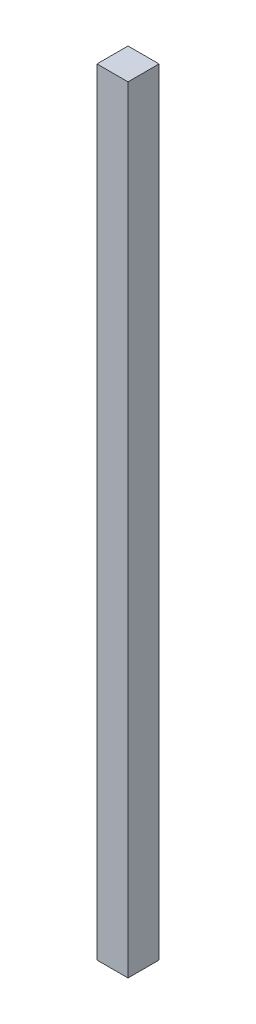
from build123d import *

# Parameters (mm, degrees)
SKETCH_1_W      = 40
SKETCH_1_H      = 40
EXTRUDE_1_DEPTH = 1000


with BuildPart() as part:
    # Эскиз1 → Бобышка-Вытянуть1 (new body)
    with BuildSketch(Plane(origin=(0, 0, 0), x_dir=(1, 0, 0), z_dir=(0, 1, 0))):
        with Locations((3.921182266, 3.272842841)):
            Rectangle(SKETCH_1_W, SKETCH_1_H)
    extrude(amount=EXTRUDE_1_DEPTH)


solid = part.part
